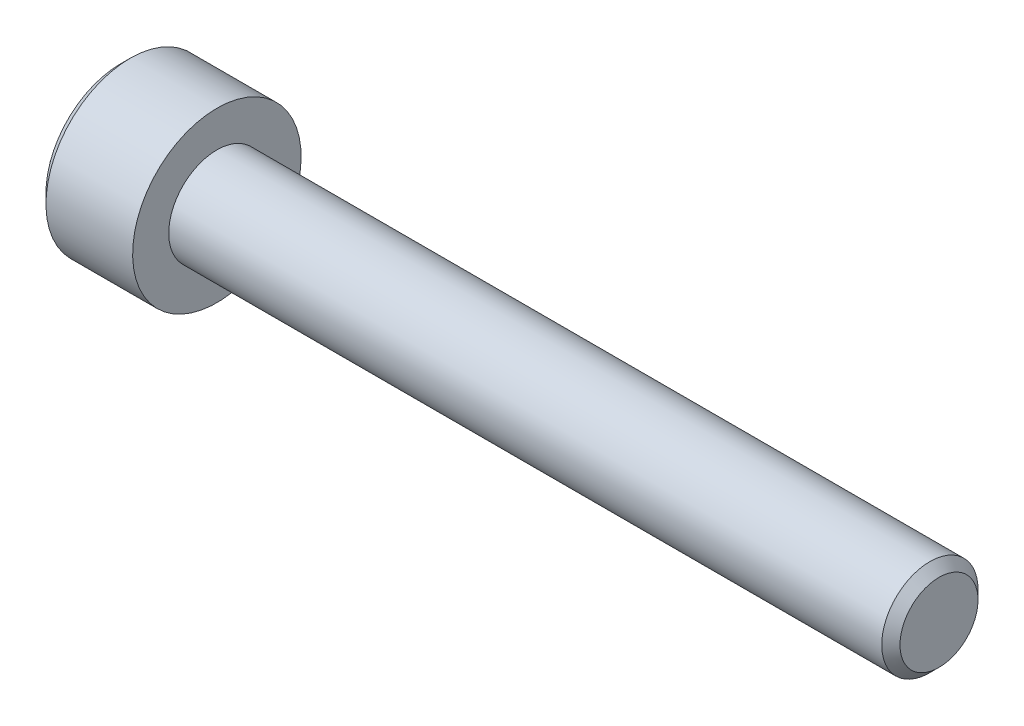
from build123d import *

# Parameters (mm, degrees)
CUT_EXTRUDE1_DEPTH = 2


with BuildPart() as part:
    # Sketch1 → Revolve1 (revolve)
    with BuildSketch(Plane.XY):
        Polygon((0, 2), (0, 3.5), (-3.6, 3.5), (-4, 3.1), (-4, 0), (30, 0), (30, 1.621), (29.621, 2), align=None)
    revolve(axis=Axis((30, 0, 0), (-1, 0, 0)))

    # Sketch2 → Cut-Extrude1 (cut)
    with BuildSketch(Plane.ZY.offset(4)):
        Polygon((0, 1.732050808), (-1.5, 0.866025404), (-1.5, -0.866025404), (0, -1.732050808), (1.5, -0.866025404), (1.5, 0.866025404), align=None)
    extrude(amount=-CUT_EXTRUDE1_DEPTH, mode=Mode.SUBTRACT)


solid = part.part
